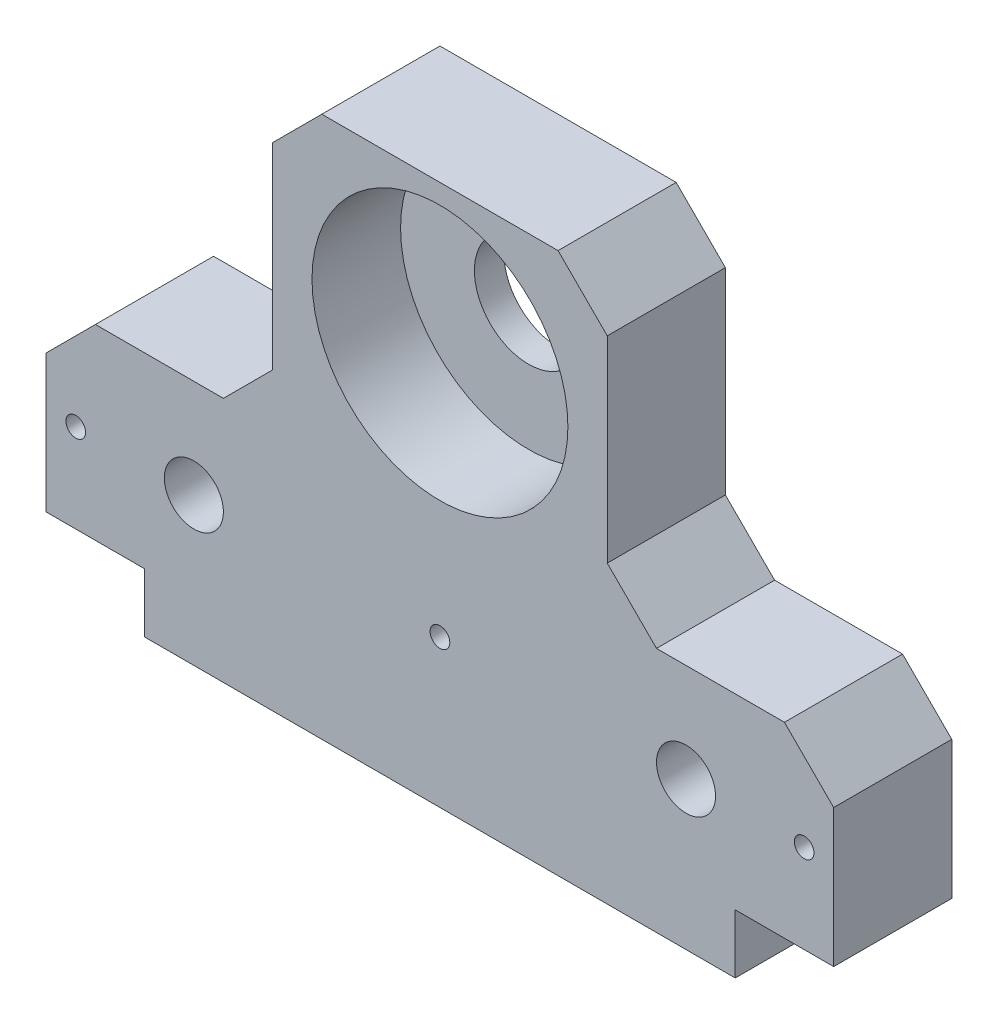
from build123d import *

# Parameters (mm, degrees)
ESQUISSE1_R             = 13
BOSS_EXTRU_1_DEPTH      = 12
BOSS_EXTRU_2_START      = -12
ESQUISSE2_R             = 13
ESQUISSE2_R_2           = 5.5
BOSS_EXTRU_2_DEPTH      = 3
ESQUISSE4_R             = 8
ENL_V_MAT_EXTRU_2_DEPTH = 6
ESQUISSE5_R             = 3
ENL_V_MAT_EXTRU_3_DEPTH = 69.271516755
ESQUISSE6_W             = 10
ESQUISSE6_H             = 6
ENL_V_MAT_EXTRU_4_DEPTH = 12
CHANFREIN1_SIZE         = 5
ESQUISSE7_R             = 1
ENL_V_MAT_EXTRU_5_DEPTH = 12


with BuildPart() as part:
    # Esquisse1 → Boss.-Extru.1 (new body)
    with BuildSketch(Plane.XY):
        Polygon((-40, 0), (40, 0), (40, 25), (17, 25), (17, 55), (-17, 55), (-17, 25), (-40, 25), align=None)
        with Locations((0, 40)):
            Circle(ESQUISSE1_R, mode=Mode.SUBTRACT)
    extrude(amount=BOSS_EXTRU_1_DEPTH)

    # Esquisse2 → Boss.-Extru.2 (add)
    with BuildSketch(Plane.XY.offset(12).offset(BOSS_EXTRU_2_START)):
        with Locations((0, 40)):
            Circle(ESQUISSE2_R)
        with Locations((0, 40)):
            Circle(ESQUISSE2_R_2, mode=Mode.SUBTRACT)
    extrude(amount=BOSS_EXTRU_2_DEPTH)

    # Esquisse4 → Enlèv. mat.-Extru.2 (cut)
    with BuildSketch(Plane(origin=(0, 0, 0), x_dir=(-1, 0, 0), z_dir=(0, 0, -1))):
        with Locations((-25, 15)):
            Circle(ESQUISSE4_R)
        with Locations(Location((25, 15, 0), (0, 0, 180))):
            Circle(ESQUISSE4_R)
    extrude(amount=-ENL_V_MAT_EXTRU_2_DEPTH, mode=Mode.SUBTRACT)

    # Esquisse5 → Enlèv. mat.-Extru.3 (cut, through all)
    with BuildSketch(Plane(origin=(0, 0, 6), x_dir=(-1, 0, 0), z_dir=(0, 0, -1))):
        with Locations((-25, 15)):
            Circle(ESQUISSE5_R)
        with Locations(Location((25, 15, 0), (0, 0, 180))):
            Circle(ESQUISSE5_R)
    extrude(amount=-ENL_V_MAT_EXTRU_3_DEPTH, mode=Mode.SUBTRACT)

    # Esquisse6 → Enlèv. mat.-Extru.4 (cut)
    with BuildSketch(Plane.XY.offset(12)):
        with Locations((35, 3)):
            Rectangle(ESQUISSE6_W, ESQUISSE6_H)
        with Locations((-35, 3)):
            Rectangle(ESQUISSE6_W, ESQUISSE6_H)
    extrude(amount=-ENL_V_MAT_EXTRU_4_DEPTH, mode=Mode.SUBTRACT)

    # Chanfrein1
    chanfrein1_edges = [part.edges().sort_by_distance(p)[0] for p in [
        (-17, 55, 6),
        (17, 55, 6),
        (17, 25, 6),
        (40, 25, 6),
        (-40, 25, 6),
        (-17, 25, 6),
    ]]
    chamfer(chanfrein1_edges, length=CHANFREIN1_SIZE)

    # Esquisse7 → Enlèv. mat.-Extru.5 (cut)
    with BuildSketch(Plane(origin=(0, 0, 0), x_dir=(-1, 0, 0), z_dir=(0, 0, -1))):
        with Locations((-10, 45)):
            Circle(ESQUISSE7_R)
        with Locations(Location((10, 45, 0), (0, 0, 180))):
            Circle(ESQUISSE7_R)
        with Locations((-37, 15)):
            Circle(ESQUISSE7_R)
        with Locations(Location((37, 15, 0), (0, 0, 180))):
            Circle(ESQUISSE7_R)
        with Locations((0, 15)):
            Circle(ESQUISSE7_R)
    extrude(amount=-ENL_V_MAT_EXTRU_5_DEPTH, mode=Mode.SUBTRACT)


solid = part.part
